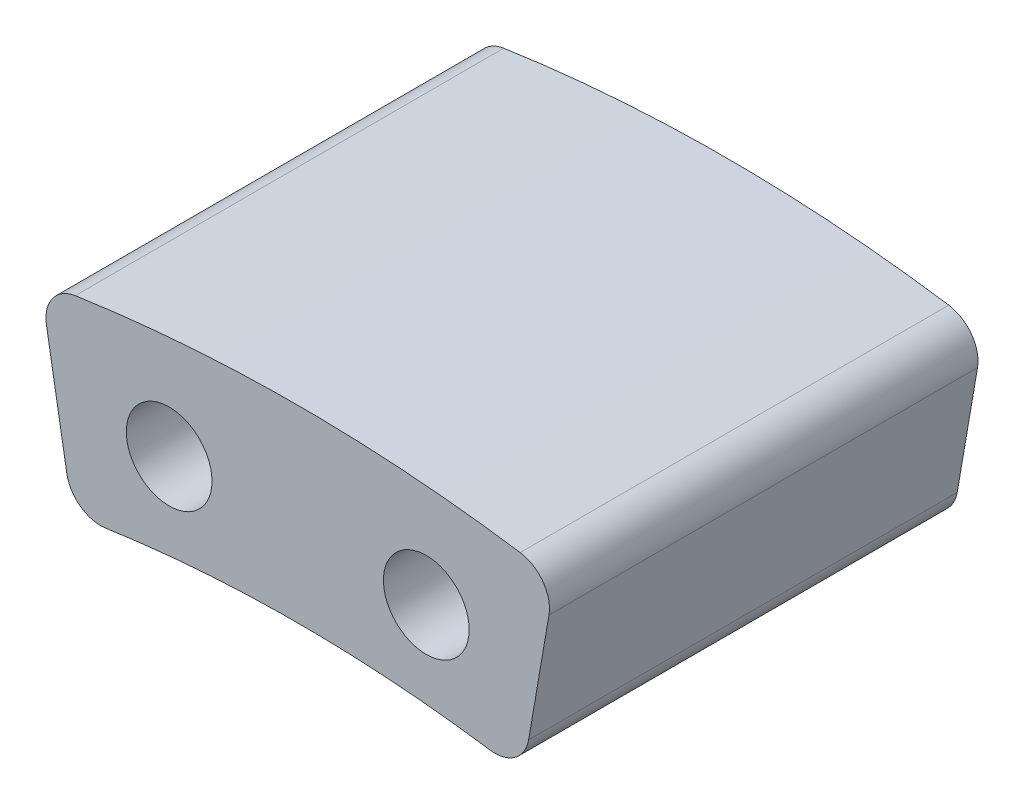
from build123d import *

# Parameters (mm, degrees)
SKETCH1_R           = 3.175
BOSS_EXTRUDE1_DEPTH = 31.75
FILLET1_R           = 2.54


with BuildPart() as part:
    # Sketch1 → Boss-Extrude1 (new body)
    with BuildSketch(Plane.XY):
        with BuildLine():
            Line((-19.05, 110.768829212), (-16.68220339, 97.000952135))
            ThreePointArc((-16.68220339, 97.000952135), (0, 98.425), (16.68220339, 97.000952135))
            Line((16.68220339, 97.000952135), (19.05, 110.768829212))
            ThreePointArc((19.05, 110.768829212), (0, 112.395), (-19.05, 110.768829212))
        make_face()
        with Locations((9.525, 104.341147205)):
            Circle(SKETCH1_R, mode=Mode.SUBTRACT)
        with Locations((-9.525, 104.341147205)):
            Circle(SKETCH1_R, mode=Mode.SUBTRACT)
    extrude(amount=BOSS_EXTRUDE1_DEPTH)

    # Fillet1
    fillet1_edges = [part.edges().sort_by_distance(p)[0] for p in [
        (19.05, 110.768829212, 15.875),
        (16.68220339, 97.000952135, 15.875),
        (-16.68220339, 97.000952135, 15.875),
        (-19.05, 110.768829212, 15.875),
    ]]
    fillet(fillet1_edges, radius=FILLET1_R)


solid = part.part
